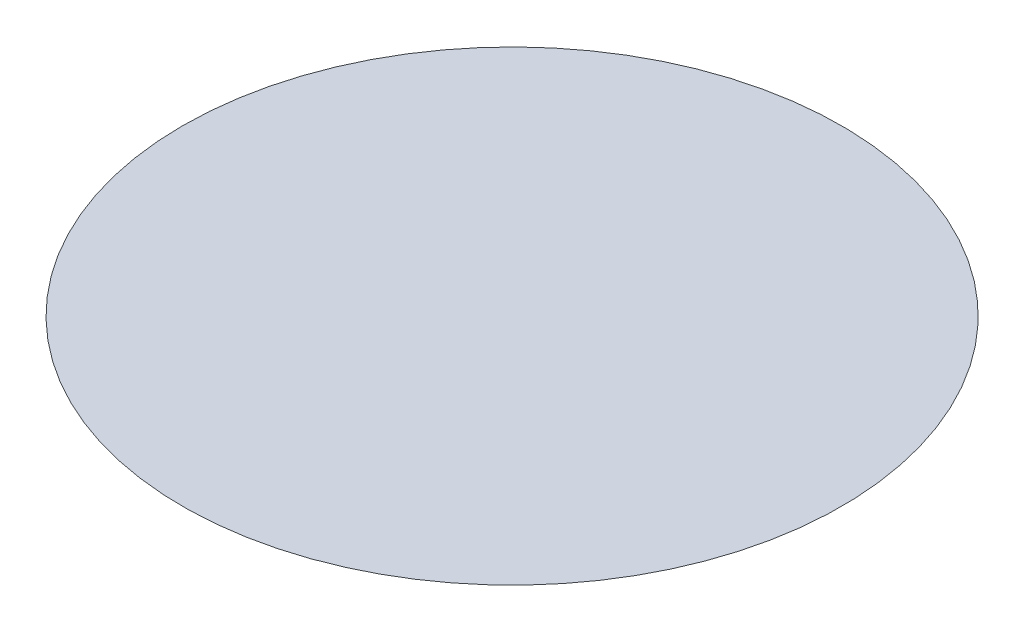
from build123d import *


with BuildPart() as part:
    # Эскиз1 → Повернуть1 (revolve)
    with BuildSketch(Plane.XY, mode=Mode.PRIVATE) as revolve_1_sk:
        with BuildLine():
            Line((0, 0), (0, -1))
            Line((0, -1), (3.041761989, -1))
            ThreePointArc((3.041761989, -1), (3.379856599, -0.92504623), (3.654597544, -0.714230088))
            Line((3.654597544, -0.714230088), (3.774328891, -0.571539825))
            ThreePointArc((3.774328891, -0.571539825), (4.323810781, -0.149907541), (5, 0))
            Line((5, 0), (2.375676293, 0))
            Line((2.375676293, 0), (0, 0))
        make_face()
    revolve(revolve_1_sk.sketch.rotate(Axis((0, 0, 0), (0, -1, 0)), 180), axis=Axis((0, 0, 0), (0, -1, 0)))


solid = part.part
